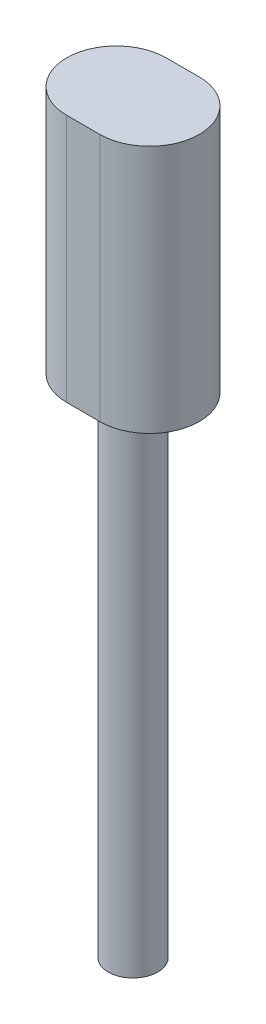
from build123d import *

# Parameters (mm, degrees)
EXTRUDE_1_DEPTH = 15
SKETCH_3_R      = 1.5
EXTRUDE_2_DEPTH = 30


with BuildPart() as part:
    # 草图2 → 凸台-拉伸1 (new body)
    with BuildSketch(Plane(origin=(0, 0, 0), x_dir=(1, 0, 0), z_dir=(0, 1, 0))):
        with BuildLine():
            Line((-1, 3), (1, 3))
            ThreePointArc((1, 3), (4, 0), (1, -3))
            Line((1, -3), (-1, -3))
            ThreePointArc((-1, -3), (-4, 0), (-1, 3))
        make_face()
    extrude(amount=EXTRUDE_1_DEPTH)

    # 草图3 → 凸台-拉伸2 (add)
    with BuildSketch(Plane(origin=(0, 0, 0), x_dir=(1, 0, 0), z_dir=(0, 1, 0))):
        with Locations(Location((0, 0, 0), (0, 0, 270))):
            Circle(SKETCH_3_R)
    extrude(amount=-EXTRUDE_2_DEPTH)


solid = part.part
